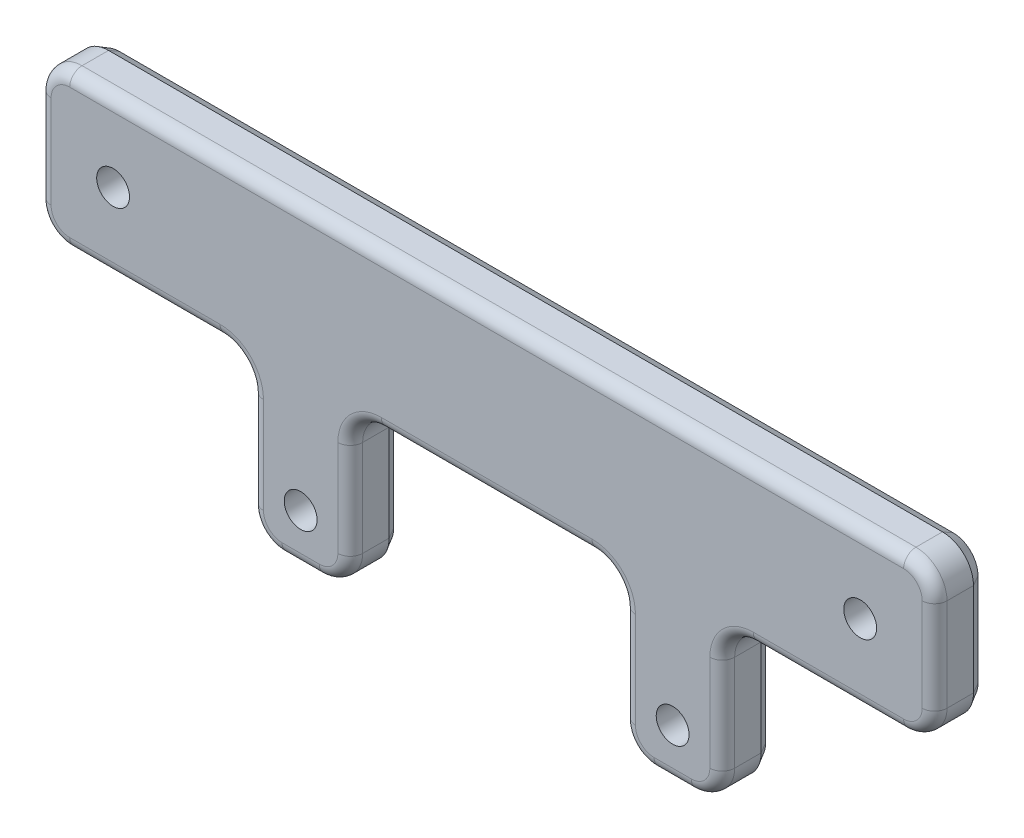
from build123d import *
from OCP.BRepFilletAPI import BRepFilletAPI_MakeChamfer

# Parameters (mm, degrees)
SKETCH2_W           = 144.5
SKETCH2_H           = 25
BOSS_EXTRUDE1_DEPTH = 8
SKETCH3_R           = 2.65
CUT_EXTRUDE1_DEPTH  = 74.758474089
SKETCH5_W           = 16
SKETCH5_H           = 25.5
SKETCH5_R           = 2.65
BOSS_EXTRUDE2_DEPTH = 8
FILLET1_R           = 5
FILLET2_R           = 2
CHAMFER1_SIZE       = 1
CHAMFER1_SIZE2      = 1.732050808
CHAMFER2_SIZE       = 1
CHAMFER2_SIZE2      = 0.577350269


with BuildPart() as part:
    # Sketch2 → Boss-Extrude1 (new body)
    with BuildSketch(Plane.XY):
        Rectangle(SKETCH2_W, SKETCH2_H)
    extrude(amount=BOSS_EXTRUDE1_DEPTH)

    # Sketch3 → Cut-Extrude1 (cut, through all)
    with BuildSketch(Plane.XY.offset(8)):
        with Locations((-60.25, 0)):
            Circle(SKETCH3_R)
        with Locations((60.25, 0)):
            Circle(SKETCH3_R)
    extrude(amount=-CUT_EXTRUDE1_DEPTH, mode=Mode.SUBTRACT)

    # Sketch5 → Boss-Extrude2 (add)
    # profile 1 of 2: a face of its own
    with BuildSketch(Plane.XY.offset(8)):
        with Locations((-30, -25.25)):
            Rectangle(SKETCH5_W, SKETCH5_H)
        with Locations((-30, -30)):
            Circle(SKETCH5_R, mode=Mode.SUBTRACT)
    # profile 2 of 2: a face of its own
    with BuildSketch(Plane.XY.offset(8)):
        with Locations((30, -25.25)):
            Rectangle(SKETCH5_W, SKETCH5_H)
        with Locations(Location((30, -30, 0), (0, 0, 180))):
            Circle(SKETCH5_R, mode=Mode.SUBTRACT)
    extrude(amount=-BOSS_EXTRUDE2_DEPTH)

    # Fillet1
    fillet1_edges = [part.edges().sort_by_distance(p)[0] for p in [
        (-38, -38, 4),
        (-38, -12.5, 4),
        (-22, -12.5, 4),
        (-22, -38, 4),
        (38, -12.5, 4),
        (38, -38, 4),
        (22, -38, 4),
        (22, -12.5, 4),
        (72.25, -12.5, 4),
        (-72.25, -12.5, 4),
        (-72.25, 12.5, 4),
        (72.25, 12.5, 4),
    ]]
    fillet(fillet1_edges, radius=FILLET1_R)

    # Fillet2
    fillet2_edges = [part.edges().sort_by_distance(p)[0] for p in [
        (38, -25.25, 8),
        (55.125, -12.5, 8),
        (30, -38, 8),
        (72.25, 0, 8),
        (0, 12.5, 8),
        (-72.25, 0, 8),
        (-55.125, -12.5, 8),
        (-38, -25.25, 8),
        (-30, -38, 8),
        (-22, -25.25, 8),
        (0, -12.5, 8),
        (22, -25.25, 8),
        (70.785533906, 11.035533906, 8),
        (70.785533906, -11.035533906, 8),
        (-70.785533906, 11.035533906, 8),
        (-70.785533906, -11.035533906, 8),
        (-23.464466094, -36.535533906, 8),
        (-36.535533906, -36.535533906, 8),
        (23.464466094, -36.535533906, 8),
        (36.535533906, -36.535533906, 8),
        (39.464466094, -13.964466094, 8),
        (20.535533906, -13.964466094, 8),
        (-39.464466094, -13.964466094, 8),
        (-20.535533906, -13.964466094, 8),
    ]]
    fillet(fillet2_edges, radius=FILLET2_R)

    # Chamfer1
    chamfer1_edges = [part.edges().sort_by_distance(p)[0] for p in [
        (38, -25.25, 0),
        (55.125, -12.5, 0),
        (30, -38, 0),
        (72.25, 0, 0),
        (22, -25.25, 0),
        (0, -12.5, 0),
        (-22, -25.25, 0),
        (-30, -38, 0),
        (-38, -25.25, 0),
        (-55.125, -12.5, 0),
        (-72.25, 0, 0),
        (0, 12.5, 0),
        (70.785533906, 11.035533906, 0),
        (70.785533906, -11.035533906, 0),
        (-70.785533906, 11.035533906, 0),
        (-70.785533906, -11.035533906, 0),
        (-23.464466094, -36.535533906, 0),
        (-36.535533906, -36.535533906, 0),
        (23.464466094, -36.535533906, 0),
        (36.535533906, -36.535533906, 0),
        (39.464466094, -13.964466094, 0),
        (20.535533906, -13.964466094, 0),
        (-39.464466094, -13.964466094, 0),
        (-20.535533906, -13.964466094, 0),
    ]]
    chamfer1_side = [part.faces().sort_by_distance(p)[0] for p in [
        (0, -4.348667021, 0),
    ]]
    chamfer(chamfer1_edges, length=CHAMFER1_SIZE, length2=CHAMFER1_SIZE2, reference=chamfer1_side[0])

    # Chamfer2: one chamfer whose edges measure the first distance from different faces: ONE call of the kernel's chamfer builder (chamfer() names one face for all edges)
    chamfer2_edges_1 = [part.edges().sort_by_distance(p)[0] for p in [
        (-62.9, 0, 0),
    ]]
    chamfer2_side_1 = [part.faces().sort_by_distance(p)[0] for p in [
        (-62.9, 0, 4),
    ]]
    chamfer2_edges_2 = [part.edges().sort_by_distance(p)[0] for p in [
        (57.6, 0, 0),
    ]]
    chamfer2_side_2 = [part.faces().sort_by_distance(p)[0] for p in [
        (57.6, 0, 4),
    ]]
    chamfer2_edges_3 = [part.edges().sort_by_distance(p)[0] for p in [
        (-32.65, -30, 0),
    ]]
    chamfer2_side_3 = [part.faces().sort_by_distance(p)[0] for p in [
        (-32.65, -30, 4),
    ]]
    chamfer2_edges_4 = [part.edges().sort_by_distance(p)[0] for p in [
        (32.65, -30, 0),
    ]]
    chamfer2_side_4 = [part.faces().sort_by_distance(p)[0] for p in [
        (32.65, -30, 4),
    ]]
    chamfer2 = BRepFilletAPI_MakeChamfer(part.part.solid().wrapped)
    for e in chamfer2_edges_1:
        chamfer2.Add(CHAMFER2_SIZE, CHAMFER2_SIZE2, e.wrapped, chamfer2_side_1[0].wrapped)  # the first distance lies on this face
    for e in chamfer2_edges_2:
        chamfer2.Add(CHAMFER2_SIZE, CHAMFER2_SIZE2, e.wrapped, chamfer2_side_2[0].wrapped)  # the first distance lies on this face
    for e in chamfer2_edges_3:
        chamfer2.Add(CHAMFER2_SIZE, CHAMFER2_SIZE2, e.wrapped, chamfer2_side_3[0].wrapped)  # the first distance lies on this face
    for e in chamfer2_edges_4:
        chamfer2.Add(CHAMFER2_SIZE, CHAMFER2_SIZE2, e.wrapped, chamfer2_side_4[0].wrapped)  # the first distance lies on this face
    add(Compound.cast(chamfer2.Shape()), mode=Mode.REPLACE)


solid = part.part
